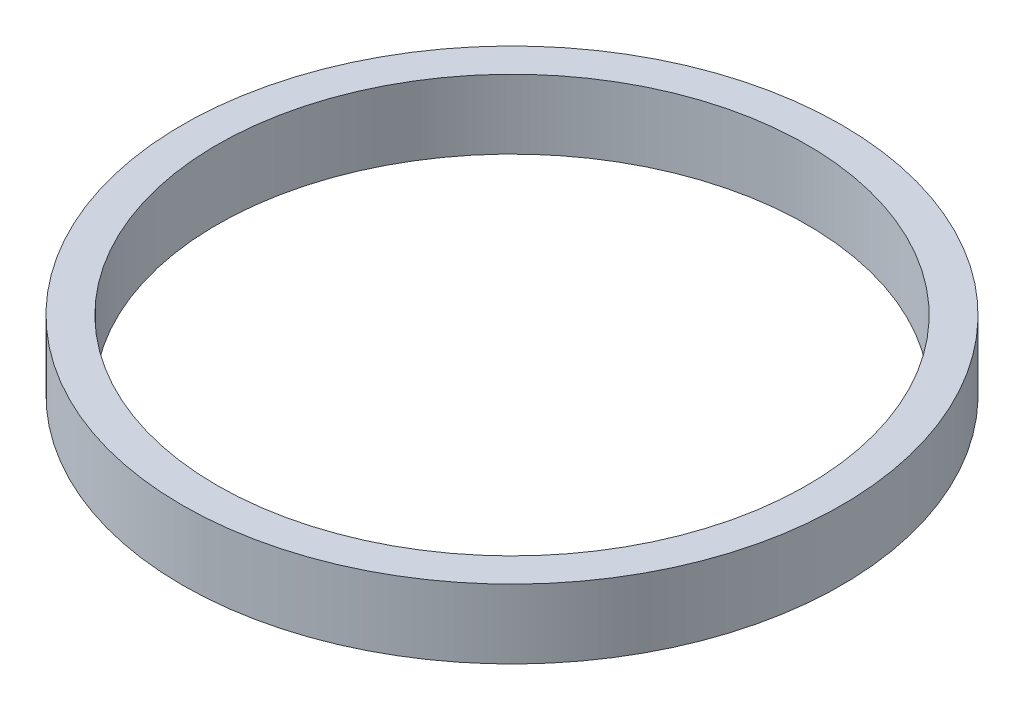
from build123d import *

# Parameters (mm, degrees)
SKETCH1_R           = 47.65
SKETCH1_R_2         = 42.65
BOSS_EXTRUDE1_DEPTH = 10


with BuildPart() as part:
    # Sketch1 → Boss-Extrude1 (new body)
    with BuildSketch(Plane(origin=(0, 0, 0), x_dir=(1, 0, 0), z_dir=(0, 1, 0))):
        with Locations(Location((0, 0, 0), (0, 0, 270))):
            Circle(SKETCH1_R)
        with Locations(Location((0, 0, 0), (0, 0, 270))):
            Circle(SKETCH1_R_2, mode=Mode.SUBTRACT)
    extrude(amount=BOSS_EXTRUDE1_DEPTH)


solid = part.part
